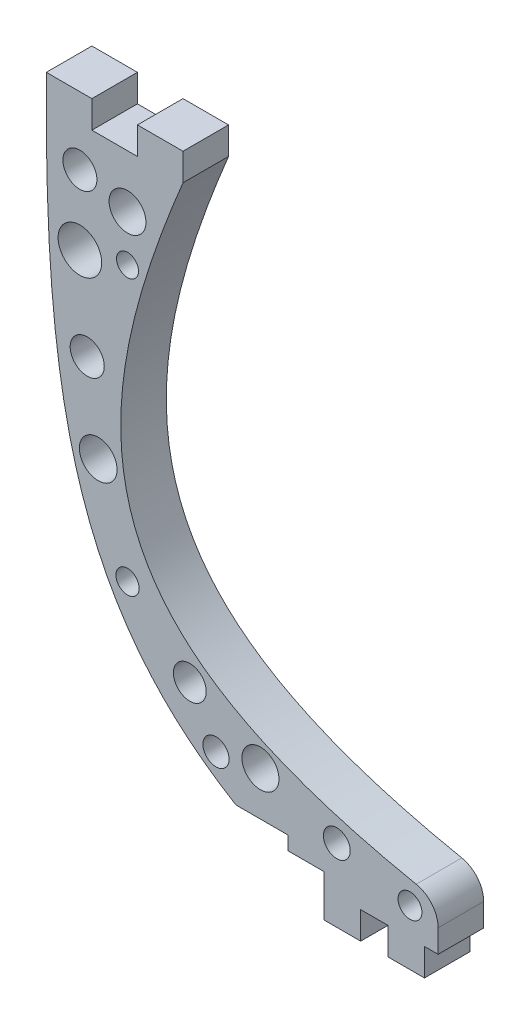
from build123d import *

# Parameters (mm, degrees)
ESQUISSE3_R             = 1.863947
ESQUISSE3_R_2           = 2.023509578
ESQUISSE3_R_3           = 2.393973193
ESQUISSE3_R_4           = 1.206253728
ESQUISSE3_R_5           = 1.870132193
ESQUISSE3_R_6           = 2.067863533
ESQUISSE3_R_7           = 1.271503072
ESQUISSE3_R_8           = 1.799094092
ESQUISSE3_R_9           = 1.436016343
ESQUISSE3_R_10          = 2.031777992
ESQUISSE3_R_11          = 1.472480674
ESQUISSE3_R_12          = 1.31161039
BOSS_EXTRU_1_DEPTH      = 5
ESQUISSE4_W             = 5.690326356
ESQUISSE4_H             = 1.5
ENL_V_MAT_EXTRU_1_DEPTH = 71.522215792
CONG_1_R                = 3


with BuildPart() as part:
    # Esquisse3 → Boss.-Extru.1 (new body)
    with BuildSketch(Plane.XY):
        with BuildLine():
            Line((30, -4.6), (30, -1.6))
            Line((30, -1.6), (27, -1.6))
            Line((27, -1.6), (27, -4.6))
            Line((27, -4.6), (23, -4.6))
            Line((23, -4.6), (23, 0))
            Line((23, 0), (16, 0))
            add(Edge.make_bspline(
                [(16, 0), (-3.777040209, 10.263449678), (-7.5, 27.800800799), (-7.5, 57.73)],
                knots=[0, 0, 0, 0, 1, 1, 1, 1], degree=3))
            Line((-7.5, 57.73), (-7.5, 60.73))
            Line((-7.5, 60.73), (-2.5, 60.73))
            Line((-2.5, 60.73), (-2.5, 57.73))
            Line((-2.5, 57.73), (0, 57.73))
            Line((0, 57.73), (2.5, 57.73))
            Line((2.5, 57.73), (2.5, 60.73))
            Line((2.5, 60.73), (7.5, 60.73))
            Line((7.5, 60.73), (7.5, 57.73))
            add(Edge.make_bspline(
                [(35.5, 3.4), (-1.775512635, 10.212780912), (-5.567144123, 26.426699492), (7.5, 57.73)],
                knots=[0, 0, 0, 0, 1, 1, 1, 1], degree=3))
            Line((35.5, 3.4), (35.5, -1.6))
            Line((35.5, -1.6), (34, -1.6))
            Line((34, -1.6), (34, -4.6))
            Line((34, -4.6), (30, -4.6))
        make_face()
        with Locations((-3.815085589, 53.309291012)):
            Circle(ESQUISSE3_R, mode=Mode.SUBTRACT)
        with Locations((1.412013898, 51.930715323)):
            Circle(ESQUISSE3_R_2, mode=Mode.SUBTRACT)
        with Locations((-3.815085589, 45.669684069)):
            Circle(ESQUISSE3_R_3, mode=Mode.SUBTRACT)
        with Locations((1.412013898, 46.875937797)):
            Circle(ESQUISSE3_R_4, mode=Mode.SUBTRACT)
        with Locations((-3.010916437, 35.962213594)):
            Circle(ESQUISSE3_R_5, mode=Mode.SUBTRACT)
        with Locations((-1.804662709, 26.829149655)):
            Circle(ESQUISSE3_R_6, mode=Mode.SUBTRACT)
        with Locations((1.412013898, 16.777035258)):
            Circle(ESQUISSE3_R_7, mode=Mode.SUBTRACT)
        with Locations((8.247451688, 10.630885312)):
            Circle(ESQUISSE3_R_8, mode=Mode.SUBTRACT)
        with Locations((11.119484373, 5.461226479)):
            Circle(ESQUISSE3_R_9, mode=Mode.SUBTRACT)
        with Locations((16, 6.322836284)):
            Circle(ESQUISSE3_R_10, mode=Mode.SUBTRACT)
        with Locations((24.383722678, 3.4)):
            Circle(ESQUISSE3_R_11, mode=Mode.SUBTRACT)
        with Locations((32.413649645, 1.491605314)):
            Circle(ESQUISSE3_R_12, mode=Mode.SUBTRACT)
    extrude(amount=BOSS_EXTRU_1_DEPTH)

    # Esquisse4 → Enlèv. mat.-Extru.1 (cut, through all)
    with BuildSketch(Plane.XY.offset(5)):
        with Locations((16.154836822, 0.75)):
            Rectangle(ESQUISSE4_W, ESQUISSE4_H)
    extrude(amount=-ENL_V_MAT_EXTRU_1_DEPTH, mode=Mode.SUBTRACT)

    # Congé1
    cong_1_edges = [part.edges().sort_by_distance(p)[0] for p in [
        (35.5, 3.4, 2.5),
    ]]
    fillet(cong_1_edges, radius=CONG_1_R)


solid = part.part
